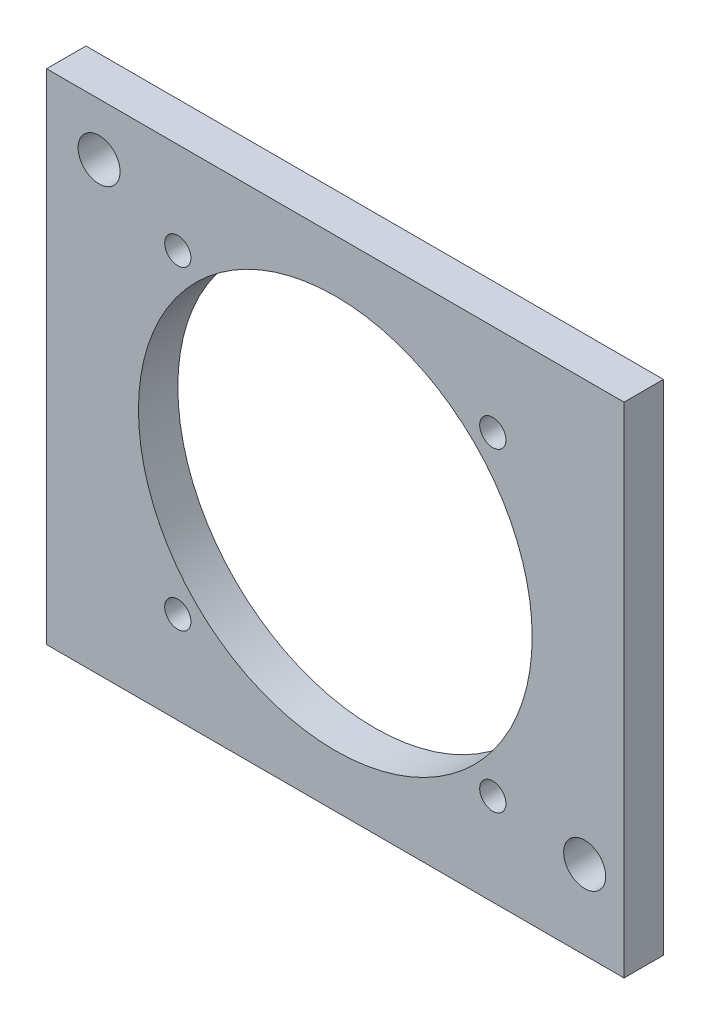
from build123d import *

# Parameters (mm, degrees)
SKETCH1_W           = 220
SKETCH1_H           = 190
BOSS_EXTRUDE1_DEPTH = 15
SKETCH2_R           = 75
SKETCH2_R_2         = 8
SKETCH2_R_3         = 5
CUT_EXTRUDE1_DEPTH  = 15


with BuildPart() as part:
    # Sketch1 → Boss-Extrude1 (new body)
    with BuildSketch(Plane.XY):
        Rectangle(SKETCH1_W, SKETCH1_H)
    extrude(amount=BOSS_EXTRUDE1_DEPTH)

    # Sketch2 → Cut-Extrude1 (cut)
    with BuildSketch(Plane.XY.offset(15)):
        Circle(SKETCH2_R)
        with Locations((-90, 75)):
            Circle(SKETCH2_R_2)
        with Locations(Location((95, -65, 0), (0, 0, 180))):
            Circle(SKETCH2_R_2)
        with Locations((-60, 60)):
            Circle(SKETCH2_R_3)
        with Locations((60, 60)):
            Circle(SKETCH2_R_3)
        with Locations((60, -60)):
            Circle(SKETCH2_R_3)
        with Locations((-60, -60)):
            Circle(SKETCH2_R_3)
    extrude(amount=-CUT_EXTRUDE1_DEPTH, mode=Mode.SUBTRACT)


solid = part.part
